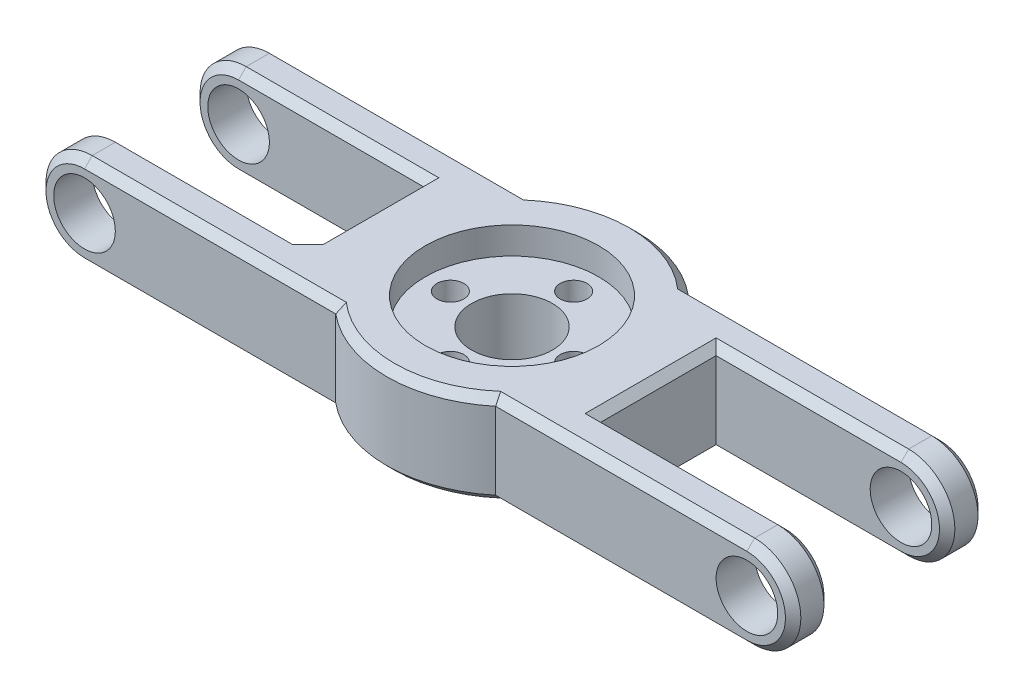
from build123d import *

# Parameters (mm, degrees)
CROQUIS1_R                 = 4
SALIENTE_EXTRUIR1_DEPTH    = 12.5
CROQUIS2_W                 = 30
CROQUIS2_H                 = 15
CORTAR_EXTRUIR1_DEPTH      = 52.973550966
CROQUIS3_R                 = 4
CORTAR_EXTRUIR2_DEPTH      = 52.973550966
CROQUIS4_R                 = 11.25
CORTAR_EXTRUIR3_DEPTH      = 3.5
CORTAR_EXTRUIR4_DEPTH      = 52.278650528
CORTAR_EXTRUIR4_DEPTH_BACK = 52.278650528
CROQUIS5_R                 = 5.25
CROQUIS6_R                 = 16.25
CROQUIS6_R_2               = 11.25
SALIENTE_EXTRUIR2_DEPTH    = 12
CHAFL_N1_SIZE              = 1
SKETCH1_R                  = 1.75
CUT_EXTRUDE1_DEPTH         = 10
CIRPATTERN1_COUNT          = 4


with BuildPart() as part:
    # Croquis1 → Saliente-Extruir1 (new, symmetric)
    with BuildSketch(Plane.XY):
        with BuildLine():
            Line((-43, 6), (43, 6))
            ThreePointArc((43, 6), (49, 0), (43, -6))
            Line((43, -6), (-43, -6))
            ThreePointArc((-43, -6), (-49, 0), (-43, 6))
        make_face()
        with Locations((-43, 0)):
            Circle(CROQUIS1_R, mode=Mode.SUBTRACT)
        with Locations((43, 0)):
            Circle(CROQUIS1_R, mode=Mode.SUBTRACT)
    extrude(amount=SALIENTE_EXTRUIR1_DEPTH, both=True)

    # Croquis2 → Cortar-Extruir1 (cut, through all)
    with BuildSketch(Plane(origin=(0, 6, 0), x_dir=(1, 0, 0), z_dir=(0, 1, 0))):
        with Locations((-34, 0)):
            Rectangle(CROQUIS2_W, CROQUIS2_H)
        with Locations((34, 0)):
            Rectangle(CROQUIS2_W, CROQUIS2_H)
    extrude(amount=-CORTAR_EXTRUIR1_DEPTH, mode=Mode.SUBTRACT)

    # Croquis3 → Cortar-Extruir2 (cut, through all)
    with BuildSketch(Plane(origin=(0, 6, 0), x_dir=(1, 0, 0), z_dir=(0, 1, 0))):
        with Locations(Location((0, 0, 0), (0, 0, 270))):
            Circle(CROQUIS3_R)
    extrude(amount=-CORTAR_EXTRUIR2_DEPTH, mode=Mode.SUBTRACT)

    # Croquis4 → Cortar-Extruir3 (cut)
    with BuildSketch(Plane(origin=(0, 6, 0), x_dir=(1, 0, 0), z_dir=(0, 1, 0))):
        with Locations(Location((0, 0, 0), (0, 0, 270))):
            Circle(CROQUIS4_R)
    extrude(amount=-CORTAR_EXTRUIR3_DEPTH, mode=Mode.SUBTRACT)

    # Croquis5 → Cortar-Extruir4 (cut, two sides: drawn at the far end of the back side and taken through both)
    with BuildSketch(Plane(origin=(0, 2.5, 0), x_dir=(1, 0, 0), z_dir=(0, 1, 0)).offset(-CORTAR_EXTRUIR4_DEPTH_BACK)):
        with Locations(Location((0, 0, 0), (0, 0, 270))):
            Circle(CROQUIS5_R)
    extrude(amount=CORTAR_EXTRUIR4_DEPTH + CORTAR_EXTRUIR4_DEPTH_BACK, mode=Mode.SUBTRACT)

    # Croquis6 → Saliente-Extruir2 (add)
    with BuildSketch(Plane(origin=(0, 6, 0), x_dir=(1, 0, 0), z_dir=(0, 1, 0))):
        Circle(CROQUIS6_R)
        with Locations(Location((0, 0, 0), (0, 0, 270))):
            Circle(CROQUIS6_R_2, mode=Mode.SUBTRACT)
    extrude(amount=-SALIENTE_EXTRUIR2_DEPTH)

    # Chaflán1
    chafl_n1_edges = [part.edges().sort_by_distance(p)[0] for p in [
        (0, -6, -16.25),
        (0, 6, -16.25),
        (0, 6, 16.25),
        (0, -6, 16.25),
        (49, 0, 12.5),
        (26.691639914, 6, 12.5),
        (-49, 0, -7.5),
        (-31, -6, -7.5),
        (-49, 0, 7.5),
        (-31, -6, 7.5),
        (-19, 0, 7.5),
        (-19, -6, 0),
        (-31, 6, 7.5),
        (-19, 6, 0),
        (-31, 6, -7.5),
        (-49, 0, 12.5),
        (26.691639914, 6, -12.5),
        (31, 6, 7.5),
        (31, 6, -7.5),
        (19, 6, 0),
        (49, 0, -7.5),
        (31, -6, -7.5),
        (49, 0, 7.5),
        (31, -6, 7.5),
        (49, 0, -12.5),
        (19, -6, 0),
        (-26.691639914, -6, -12.5),
        (-49, 0, -12.5),
        (-26.691639914, -6, 12.5),
        (-26.691639914, 6, 12.5),
        (-26.691639914, 6, -12.5),
        (26.691639914, -6, -12.5),
        (26.691639914, -6, 12.5),
    ]]
    chamfer(chafl_n1_edges, length=CHAFL_N1_SIZE)

    # Sketch1 → Cut-Extrude1 (cut)
    with BuildSketch(Plane(origin=(0, 2.5, 0), x_dir=(1, 0, 0), z_dir=(0, 1, 0))):
        with Locations(Location((0, 8, 0), (0, 0, 270))):
            Circle(SKETCH1_R)
    cut_extrude1 = extrude(amount=-CUT_EXTRUDE1_DEPTH, mode=Mode.SUBTRACT)

    # CirPattern1: Cut-Extrude1 ×4 about axis
    cirpattern1_axis = Axis((0, 0, 0), (0, 1, 0))
    for i in range(1, CIRPATTERN1_COUNT):
        add(cut_extrude1.rotate(cirpattern1_axis, i * 360 / CIRPATTERN1_COUNT), mode=Mode.SUBTRACT)


solid = part.part
